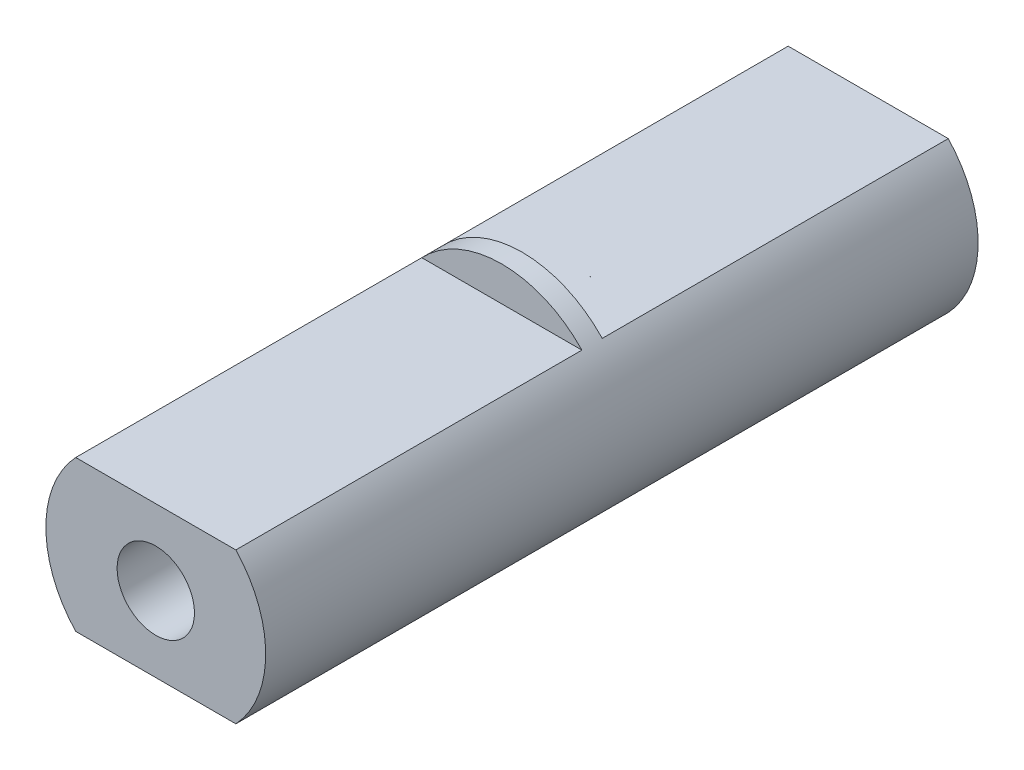
from build123d import *

# Parameters (mm, degrees)
BOSS_EXTRUDE2_DEPTH = 8.5
BOSS_EXTRUDE4_START = 9
SKETCH3_R           = 2.700000061
SKETCH3_R_2         = 0.950000005
BOSS_EXTRUDE4_DEPTH = 9
SKETCH4_R           = 0.950000005
CUT_EXTRUDE1_DEPTH  = 8.5


with BuildPart() as part:
    # Sketch2 → Boss-Extrude2 (new body)
    with BuildSketch(Plane.XY):
        with BuildLine():
            Line((0, 0.950000005), (0, 1.85))
            Line((0, 1.85), (-1.966596128, 1.85))
            ThreePointArc((-1.966596128, 1.85), (-2.700000061, 0), (-1.966596128, -1.85))
            Line((-1.966596128, -1.85), (0, -1.85))
            Line((0, -1.85), (0, -0.950000005))
            ThreePointArc((0, -0.950000005), (-0.950000005, 0), (0, 0.950000005))
        make_face()
        with BuildLine():
            Line((1.966596128, 1.85), (0, 1.85))
            Line((0, 1.85), (0, 0.950000005))
            ThreePointArc((0, 0.950000005), (0.671751446, 0.671751446), (0.950000005, 0))
            ThreePointArc((0.950000005, 0), (0.671751446, -0.671751446), (0, -0.950000005))
            Line((0, -0.950000005), (0, -1.85))
            Line((0, -1.85), (1.966596128, -1.85))
            ThreePointArc((1.966596128, -1.85), (2.700000061, 0), (1.966596128, 1.85))
        make_face()
    extrude(amount=BOSS_EXTRUDE2_DEPTH)

    # Sketch3 → Boss-Extrude4 (add)
    with BuildSketch(Plane(origin=(0, 0, 0), x_dir=(-1, 0, 0), z_dir=(0, 0, -1)).offset(BOSS_EXTRUDE4_START)):
        Circle(SKETCH3_R)
        Circle(SKETCH3_R_2, mode=Mode.SUBTRACT)
    extrude(amount=-BOSS_EXTRUDE4_DEPTH)

    # Sketch4 → Cut-Extrude1 (cut)
    with BuildSketch(Plane(origin=(0, 0, -9), x_dir=(-1, 0, 0), z_dir=(0, 0, -1))):
        Circle(SKETCH4_R)
        with BuildLine():
            Line((-1.966596128, 1.85), (1.966596128, 1.85))
            ThreePointArc((1.966596128, 1.85), (0, 2.700000061), (-1.966596128, 1.85))
        make_face()
        with BuildLine():
            Line((1.966596128, -1.85), (-1.966596128, -1.85))
            ThreePointArc((-1.966596128, -1.85), (0, -2.700000061), (1.966596128, -1.85))
        make_face()
    extrude(amount=-CUT_EXTRUDE1_DEPTH, mode=Mode.SUBTRACT)


solid = part.part
